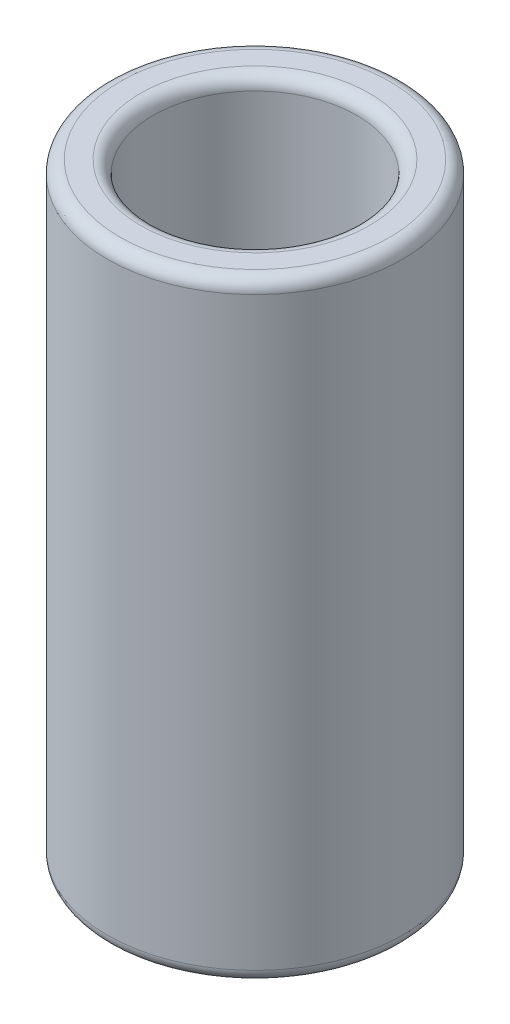
from build123d import *

# Parameters (mm, degrees)
SKETCH1_R           = 5.8
SKETCH1_R_2         = 4
BOSS_EXTRUDE1_DEPTH = 24
FILLET1_R           = 0.5
FILLET2_R           = 0.5


with BuildPart() as part:
    # Sketch1 → Boss-Extrude1 (new body)
    with BuildSketch(Plane(origin=(0, 0, 0), x_dir=(1, 0, 0), z_dir=(0, 1, 0))):
        with Locations(Location((0, 0, 0), (0, 0, 270))):
            Circle(SKETCH1_R)
        with Locations(Location((0, 0, 0), (0, 0, 270))):
            Circle(SKETCH1_R_2, mode=Mode.SUBTRACT)
    extrude(amount=BOSS_EXTRUDE1_DEPTH)

    # Fillet1
    fillet1_edges = [part.edges().sort_by_distance(p)[0] for p in [
        (0, 0, -5.8),
        (0, 24, -5.8),
    ]]
    fillet(fillet1_edges, radius=FILLET1_R)

    # Fillet2
    fillet2_edges = [part.edges().sort_by_distance(p)[0] for p in [
        (0, 0, -4),
        (0, 24, -4),
    ]]
    fillet(fillet2_edges, radius=FILLET2_R)


solid = part.part
